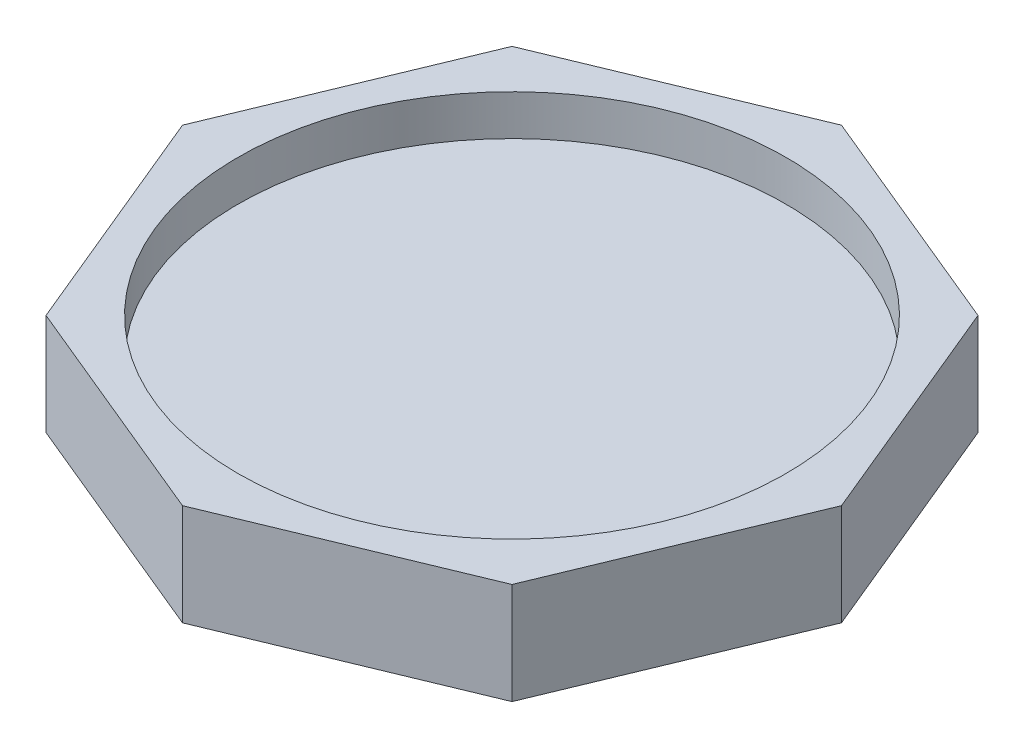
from build123d import *

# Parameters (mm, degrees)
BOSS_EXTRUDE1_DEPTH = 50
SKETCH2_R           = 135
CUT_EXTRUDE1_DEPTH  = 20


with BuildPart() as part:
    # Sketch1 → Boss-Extrude1 (new body)
    with BuildSketch(Plane(origin=(0, 0, 0), x_dir=(1, 0, 0), z_dir=(0, 1, 0))):
        Polygon((162.358830044, 0), (114.80502971, 114.80502971), (0, 162.358830044), (-114.80502971, 114.80502971), (-162.358830044, 0), (-114.80502971, -114.80502971), (0, -162.358830044), (114.80502971, -114.80502971), align=None)
    extrude(amount=BOSS_EXTRUDE1_DEPTH)

    # Sketch2 → Cut-Extrude1 (cut)
    with BuildSketch(Plane(origin=(0, 50, 0), x_dir=(1, 0, 0), z_dir=(0, 1, 0))):
        with Locations(Location((0, 0, 0), (0, 0, 270))):
            Circle(SKETCH2_R)
    extrude(amount=-CUT_EXTRUDE1_DEPTH, mode=Mode.SUBTRACT)


solid = part.part
